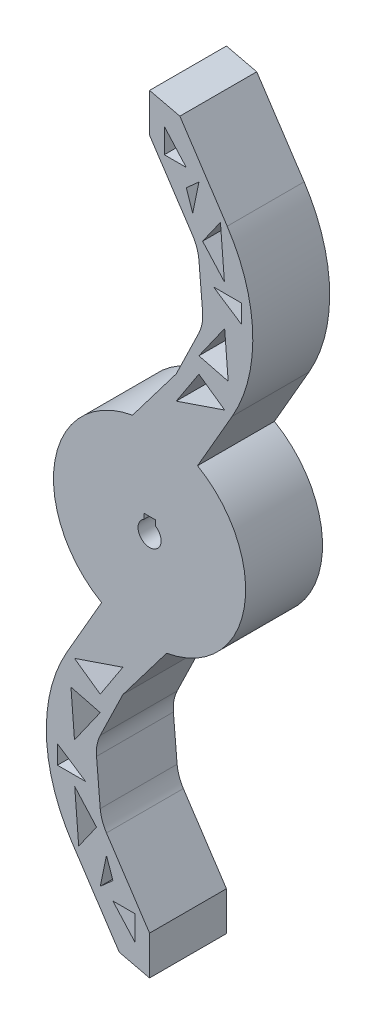
from build123d import *

# Parameters (mm, degrees)
BOSS_EXTRUDE2_DEPTH = 10
BOSS_EXTRUDE3_DEPTH = 10
SKETCH4_R           = 3
CUT_EXTRUDE2_DEPTH  = 97.50000000000003
SKETCH5_W           = 2.9999999999999996
SKETCH5_H           = 5.436144239166649
CUT_EXTRUDE3_DEPTH  = 97.50000000000003


with BuildPart() as part:
    # Sketch1 → Boss-Extrude2 (new, symmetric)
    with BuildSketch(Plane.XY):
        with BuildLine():
            ThreePointArc((25, 0), (21.645300725418316, 12.509234848950804), (12.48152347950358, 21.661292012033837))
            ThreePointArc((12.48152347950358, 21.661292012033837), (4.28784793672588, 24.62954242513481), (-4.426865135345868, 24.604935786818448))
            ThreePointArc((-4.426865135345868, 24.604935786818448), (-24.629542425134808, 4.287847936725893), (-12.481523479503583, -21.661292012033833))
            ThreePointArc((-12.481523479503583, -21.661292012033833), (-4.287847936725894, -24.629542425134808), (4.426865135345872, -24.604935786818448))
            ThreePointArc((4.426865135345872, -24.604935786818448), (19.17904622737594, -16.036339538940197), (25, -6.12e-15))
        make_face()
    extrude(amount=BOSS_EXTRUDE2_DEPTH, both=True)

    # Sketch1<3> → Boss-Extrude3 (add, symmetric)
    # profile 1 of 2: a face of its own
    with BuildSketch(Plane.XY):
        with BuildLine():
            Line((7.884503622185871, 98.13875635188714), (0, 100))
            Line((0, 100), (0, 89.88888944193812))
            Line((0, 89.88888944193812), (11.213955839011007, 72.92107946844857))
            ThreePointArc((11.213955839011007, 72.92107946844857), (12.316550372656614, 70.69184504913264), (12.834937174754405, 68.25946433771043))
            Line((12.834937174754403, 68.25946433771043), (13.800806715779299, 56.96435029183125))
            ThreePointArc((13.800806715779299, 56.96435029183125), (13.669977908403055, 54.29138507792813), (12.834937174754405, 51.74883396050234))
            Line((12.834937174754405, 51.74883396050234), (6.9408608007812065, 39.59494800864677))
            Line((6.9408608007812065, 39.59494800864677), (-4.426865135345866, 24.604935786818455))
            ThreePointArc((-4.426865135345868, 24.604935786818448), (4.28784793672588, 24.62954242513481), (12.48152347950358, 21.661292012033837))
            Line((12.48152347950358, 21.661292012033837), (21.497992967547173, 37.3090916431309))
            ThreePointArc((21.497992967547184, 37.30909164313089), (26.841650784941862, 58.58591551416716), (20.205597304410567, 79.49573873465448))
            Line((20.20559730441056, 79.49573873465448), (7.884503622185871, 98.13875635188714))
        make_face()
        Polygon((19.53338673071413, 37.74573428428377), (6.9408608007812065, 33.45058119297329), (12.834937174754405, 42.47223772885839), align=None, mode=Mode.SUBTRACT)
        Polygon((3.837169059910087, 87.41506901436794), (3.837169059910087, 93.80229693129422), (9.546066599836061, 87.41506901436794), align=None, mode=Mode.SUBTRACT)
        Polygon((9.546066599836061, 82.82716309982816), (12.834937174754405, 85.76675213258054), (11.213955839011007, 77.93724694409028), align=None, mode=Mode.SUBTRACT)
        Polygon((20.448297379263852, 44.6809874579877), (12.834937174754405, 46.619226190129275), (19.53338673071413, 56.11233816601091), align=None, mode=Mode.SUBTRACT)
        Polygon((13.800806715779299, 72.92107946844857), (18.439962300817417, 79.49573873465448), (19.474189611668198, 66.57358604040863), align=None, mode=Mode.SUBTRACT)
        Polygon((23.968839315475996, 59.18764241375836), (16.637498163723752, 64.03815423191097), (23.968839315475996, 64.03815423191097), align=None, mode=Mode.SUBTRACT)
    # profile 2 of 2: a face of its own
    with BuildSketch(Plane.XY):
        with BuildLine():
            Line((-6.9408608007812065, -39.59494800864677), (4.426865135345866, -24.604935786818455))
            ThreePointArc((4.426865135345872, -24.604935786818448), (-4.287847936725894, -24.629542425134808), (-12.481523479503583, -21.661292012033833))
            Line((-12.48152347950358, -21.661292012033837), (-21.497992967547173, -37.3090916431309))
            ThreePointArc((-21.49799296754719, -37.3090916431309), (-26.841650784941862, -58.58591551416717), (-20.205597304410567, -79.49573873465448))
            Line((-20.20559730441056, -79.49573873465448), (-7.884503622185871, -98.13875635188714))
            Line((-7.884503622185871, -98.13875635188714), (0, -100))
            Line((0, -100), (0, -89.88888944193812))
            Line((0, -89.88888944193812), (-11.213955839011007, -72.92107946844857))
            ThreePointArc((-11.213955839011007, -72.92107946844857), (-12.316550372656614, -70.69184504913264), (-12.834937174754405, -68.25946433771043))
            Line((-12.834937174754403, -68.25946433771043), (-13.800806715779299, -56.96435029183125))
            ThreePointArc((-13.800806715779299, -56.96435029183125), (-13.669977908403055, -54.29138507792813), (-12.834937174754405, -51.74883396050234))
            Line((-12.834937174754405, -51.74883396050234), (-6.9408608007812065, -39.59494800864677))
        make_face()
        Polygon((-23.968839315475996, -59.18764241375836), (-16.637498163723752, -64.03815423191097), (-23.968839315475996, -64.03815423191097), align=None, mode=Mode.SUBTRACT)
        Polygon((-13.800806715779299, -72.92107946844857), (-18.439962300817417, -79.49573873465448), (-19.474189611668198, -66.57358604040863), align=None, mode=Mode.SUBTRACT)
        Polygon((-20.448297379263852, -44.6809874579877), (-12.834937174754405, -46.619226190129275), (-19.53338673071413, -56.11233816601091), align=None, mode=Mode.SUBTRACT)
        Polygon((-9.546066599836061, -82.82716309982816), (-12.834937174754405, -85.76675213258054), (-11.213955839011007, -77.93724694409028), align=None, mode=Mode.SUBTRACT)
        Polygon((-3.837169059910087, -87.41506901436794), (-3.837169059910087, -93.80229693129422), (-9.546066599836061, -87.41506901436794), align=None, mode=Mode.SUBTRACT)
        Polygon((-19.53338673071413, -37.74573428428377), (-6.9408608007812065, -33.45058119297329), (-12.834937174754405, -42.47223772885839), align=None, mode=Mode.SUBTRACT)
    extrude(amount=BOSS_EXTRUDE3_DEPTH, both=True)

    # Sketch4 → Cut-Extrude2 (cut, symmetric)
    with BuildSketch(Plane(origin=(0, 0, -10), x_dir=(-1, 0, 0), z_dir=(0, 0, -1))):
        Circle(SKETCH4_R)
    extrude(amount=CUT_EXTRUDE2_DEPTH, both=True, mode=Mode.SUBTRACT)

    # Sketch5 → Cut-Extrude3 (cut, symmetric)
    with BuildSketch(Plane(origin=(0, 0, -10), x_dir=(-1, 0, 0), z_dir=(0, 0, -1))):
        with Locations((-2.2e-16, 1.2801544176002273)):
            Rectangle(SKETCH5_W, SKETCH5_H)
    extrude(amount=CUT_EXTRUDE3_DEPTH, both=True, mode=Mode.SUBTRACT)


solid = part.part
